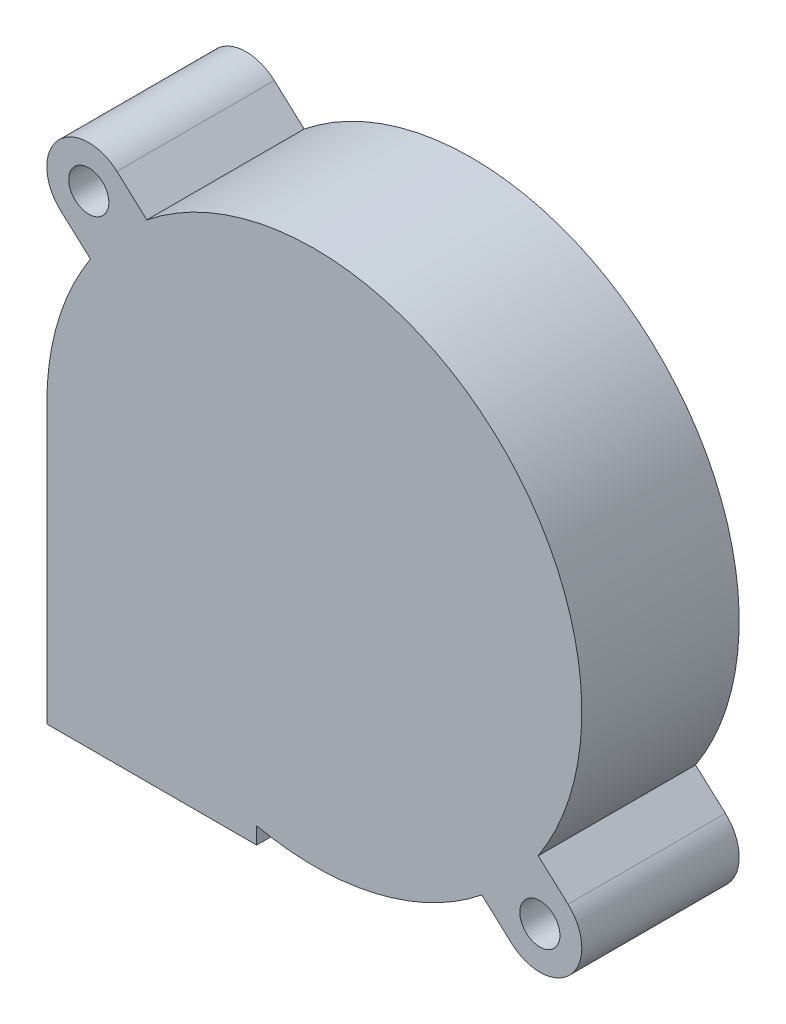
from build123d import *

# Parameters (mm, degrees)
SKETCH_2_R      = 1.912823122
EXTRUDE_1_DEPTH = 15


with BuildPart() as part:
    # Эскиз2 → Бобышка-Вытянуть1 (new body)
    with BuildSketch(Plane.XY):
        with BuildLine():
            ThreePointArc((44.312740246, 4.037123861), (49.962876139, 4.312740246), (49.687259754, 9.962876139))
            Line((49.687259754, 9.962876139), (46.841765339, 12.543673399))
            ThreePointArc((46.841765339, 12.543673399), (42.631280931, 45.388335386), (9.532754169, 46.382078879))
            Line((9.532754169, 46.382078879), (6.687259754, 48.962876139))
            ThreePointArc((6.687259754, 48.962876139), (1.037123861, 48.687259754), (1.312740246, 43.037123861))
            Line((1.312740246, 43.037123861), (4.158234661, 40.456326601))
            ThreePointArc((4.158234661, 40.456326601), (1.061659056, 33.78131114), (0, 26.5))
            Line((0, 26.5), (0, 0))
            Line((0, 0), (20, 0))
            Line((20, 0), (20, 1.600200804))
            ThreePointArc((20, 1.600200804), (31.30389422, 1.669276855), (41.467245831, 6.617921121))
            Line((41.467245831, 6.617921121), (44.312740246, 4.037123861))
        make_face()
        with Locations((47, 7)):
            Circle(SKETCH_2_R, mode=Mode.SUBTRACT)
        with Locations((4, 46)):
            Circle(SKETCH_2_R, mode=Mode.SUBTRACT)
    extrude(amount=EXTRUDE_1_DEPTH)


solid = part.part
